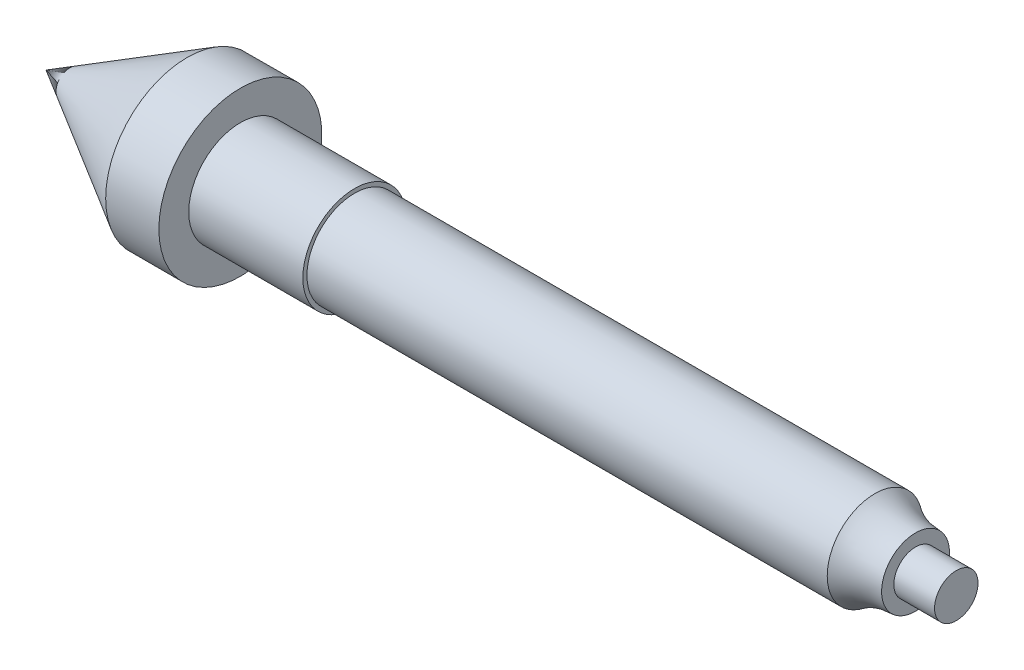
from build123d import *

# Parameters (mm, degrees)
SKETCH1_W = 191.470180192
SKETCH1_H = 17.5


with BuildPart() as part:
    # Sketch1 → Revolve4 (revolve)
    with BuildSketch(Plane.XY, mode=Mode.PRIVATE) as revolve4_sk:
        Polygon((-14.631119083, 30), (-66.59264331, 0), (-14.631119083, 0), align=None)
        Polygon((4.937176498, 30), (-14.631119083, 30), (-14.631119083, 0), (4.937176498, 0), (4.937176498, 19), align=None)
        Polygon((4.937176498, 19), (4.937176498, 0), (46.937176498, 0), (46.937176498, 17.5), (46.937176498, 19), align=None)
        with Locations((142.672266594, 8.75)):
            Rectangle(SKETCH1_W, SKETCH1_H)
        with BuildLine():
            Line((238.40735669, 17.5), (238.40735669, 0))
            Line((238.40735669, 0), (268.40735669, 0))
            Line((268.40735669, 0), (268.40735669, 8))
            Line((268.40735669, 8), (253.40735669, 8))
            Line((253.40735669, 8), (253.40735669, 12.5))
            ThreePointArc((253.40735669, 12.5), (245.501662539, 13.782917549), (238.40735669, 17.5))
        make_face()
    revolve(revolve4_sk.sketch.rotate(Axis((-83.378075763, 0, 0), (1, 0, 0)), 90), axis=Axis((-83.378075763, 0, 0), (1, 0, 0)))


solid = part.part
